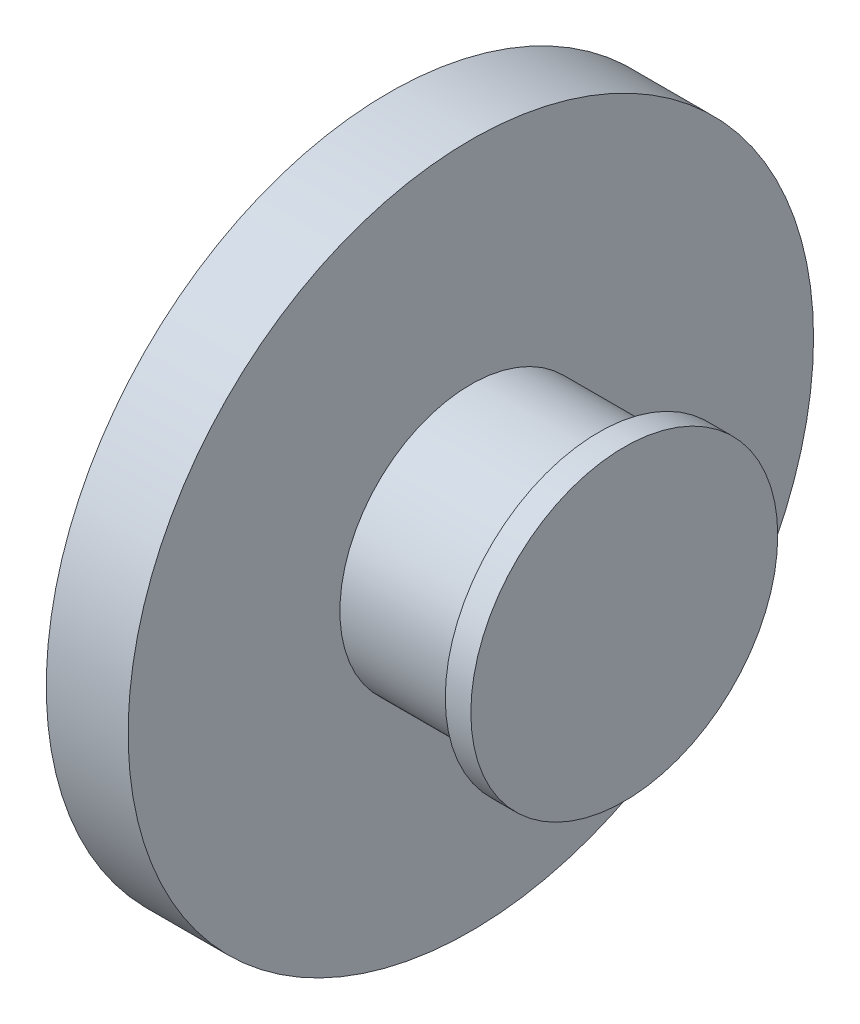
from build123d import *

# Parameters (mm, degrees)
SKETCH2_R           = 33.5
BOSS_EXTRUDE1_DEPTH = 8
SKETCH7_R           = 12.8
BOSS_EXTRUDE2_DEPTH = 12.5
SKETCH8_R           = 15
BOSS_EXTRUDE3_DEPTH = 2.5
CUT_EXTRUDE1_DEPTH  = 5.5
SKETCH11_R          = 6
CUT_EXTRUDE2_DEPTH  = 3.2


with BuildPart() as part:
    # Sketch2 → Boss-Extrude1 (new body)
    with BuildSketch(Plane(origin=(0, 0, 0), x_dir=(0, 0, -1), z_dir=(1, 0, 0))):
        Circle(SKETCH2_R)
    extrude(amount=BOSS_EXTRUDE1_DEPTH)

    # Sketch7 → Boss-Extrude2 (add)
    with BuildSketch(Plane(origin=(8, 0, 0), x_dir=(0, 0, -1), z_dir=(1, 0, 0))):
        Circle(SKETCH7_R)
    extrude(amount=BOSS_EXTRUDE2_DEPTH)

    # Sketch8 → Boss-Extrude3 (add)
    with BuildSketch(Plane(origin=(20.5, 0, 0), x_dir=(0, 0, -1), z_dir=(1, 0, 0))):
        Circle(SKETCH8_R)
    extrude(amount=BOSS_EXTRUDE3_DEPTH)

    # Sketch10 → Cut-Extrude1 (cut)
    with BuildSketch(Plane.ZY):
        with BuildLine():
            Line((-4, -27.203944189), (-6.5, -6.5))
            Line((-6.5, -6.5), (-27.203944189, -4))
            ThreePointArc((-27.203944189, -4), (-30.75, 0), (-27.203944189, 4))
            Line((-27.203944189, 4), (-6.5, 6.5))
            Line((-6.5, 6.5), (-4, 27.203944189))
            ThreePointArc((-4, 27.203944189), (0, 30.75), (4, 27.203944189))
            Line((4, 27.203944189), (6.5, 6.5))
            Line((6.5, 6.5), (27.203944189, 4))
            ThreePointArc((27.203944189, 4), (30.75, 0), (27.203944189, -4))
            Line((27.203944189, -4), (6.5, -6.5))
            Line((6.5, -6.5), (4, -27.203944189))
            ThreePointArc((4, -27.203944189), (0, -30.75), (-4, -27.203944189))
        make_face()
    extrude(amount=-CUT_EXTRUDE1_DEPTH, mode=Mode.SUBTRACT)

    # Sketch11 → Cut-Extrude2 (cut)
    with BuildSketch(Plane.ZY.offset(-5.5)):
        Circle(SKETCH11_R)
    extrude(amount=-CUT_EXTRUDE2_DEPTH, mode=Mode.SUBTRACT)


solid = part.part
